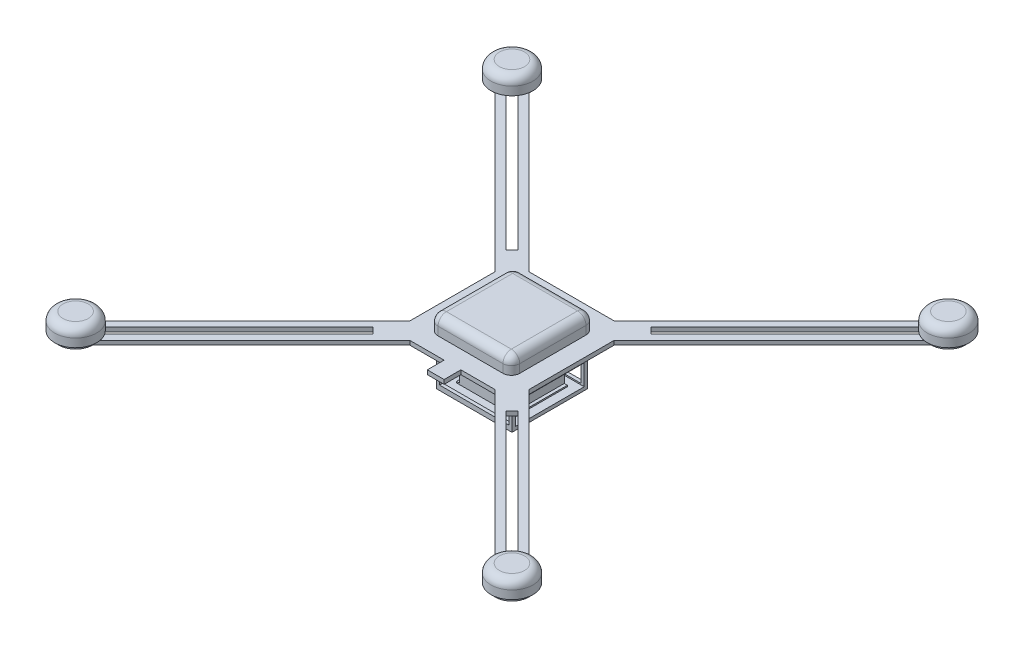
from build123d import *

# Parameters (mm, degrees)
EXTRUDE_1_DEPTH     = 5
SKETCH_2_W          = 90
SKETCH_2_H          = 90
EXTRUDE_2_DEPTH     = 25
SKETCH_3_W          = 82.667839838
SKETCH_3_H          = 15.058257345
CUT_EXTRUDE_1_DEPTH = 90
SKETCH_4_W          = 82.085695662
SKETCH_4_H          = 16.995101666
CUT_EXTRUDE_2_DEPTH = 90
SKETCH_5_W          = 97.364780094
SKETCH_5_H          = 98.94366842
EXTRUDE_3_DEPTH     = 20
FILLET_1_R          = 10
SKETCH_6_W          = 90
SKETCH_6_H          = 90
EXTRUDE_4_DEPTH     = 30
CUT_EXTRUDE_3_DEPTH = 90
SKETCH_8_W          = 62.667839838
SKETCH_8_H          = 13.124346315
CUT_EXTRUDE_4_DEPTH = 10
CUT_EXTRUDE_5_DEPTH = 90
SKETCH_10_W         = 62.085695662
SKETCH_10_H         = 21.626220655
CUT_EXTRUDE_6_DEPTH = 10
SKETCH_11_W         = 62.667839838
SKETCH_11_H         = 13.124346315
CUT_EXTRUDE_7_DEPTH = 10
SKETCH_12_W         = 62.085695662
SKETCH_12_H         = 21.626220655
CUT_EXTRUDE_8_DEPTH = 10
EXTRUDE_5_DEPTH     = 20
SKETCH_14_R         = 25
EXTRUDE_6_DEPTH     = 20
FILLET_2_R          = 10
SCALE_1_SCALE       = 0.5


with BuildPart() as part:
    # 草图1 → 凸台-拉伸1 (new body)
    with BuildSketch(Plane(origin=(0, 0, 0), x_dir=(1, 0, 0), z_dir=(0, 1, 0))):
        Polygon((0, 70.903454713), (0, 0), (70.90345471, 0), (70.90345471, 50.896669322), (70.90345471, 63.546624398), (70.90345471, 70.903454713), (63.546624395, 70.903454713), (50.896669319, 70.903454713), align=None)
        Polygon((72.962659229, 92.969444623), (50.896669319, 70.903454713), (63.546624395, 70.903454713), (79.287636767, 86.644467085), align=None)
        Polygon((70.90345471, 70.903454713), (70.90345471, 63.546624398), (86.644467082, 79.28763677), (79.287636767, 86.644467085), (63.546624395, 70.903454713), align=None)
        Polygon((70.90345471, 63.546624398), (70.90345471, 50.896669322), (92.96944462, 72.962659232), (86.644467082, 79.28763677), align=None)
        with BuildLine():
            ThreePointArc((242.661241038, 250.018071355), (240.67172678, 254.833829646), (239.993214606, 260))
            Line((239.993214606, 260), (72.962659229, 92.969444623))
            Line((72.962659229, 92.969444623), (79.287636767, 86.644467085))
            Line((79.287636767, 86.644467085), (242.661241038, 250.018071355))
        make_face()
        with BuildLine():
            Line((92.96944462, 72.962659232), (260, 239.993214612))
            ThreePointArc((260, 239.993214606), (254.833829644, 240.67172678), (250.018071352, 242.66124104))
            Line((250.018071352, 242.66124104), (86.644467082, 79.28763677))
            Line((86.644467082, 79.28763677), (92.96944462, 72.962659232))
        make_face()
        with BuildLine():
            Line((260, 252.643169688), (260, 239.993214612))
            ThreePointArc((260, 239.993214606), (274.146933622, 245.853066378), (280.006785394, 260))
            ThreePointArc((280.006785394, 260), (260, 280.006785394), (239.993214606, 260))
            Line((239.993214606, 260), (252.643169682, 260))
            Line((252.643169682, 260), (260, 260))
            Line((260, 260), (260, 252.643169688))
        make_face()
        with BuildLine():
            Line((252.643169682, 260), (239.993214606, 260))
            ThreePointArc((239.993214606, 260), (240.67172678, 254.833829646), (242.661241038, 250.018071355))
            Line((242.661241038, 250.018071355), (252.643169682, 260))
        make_face()
        with BuildLine():
            ThreePointArc((250.018071352, 242.66124104), (254.833829644, 240.67172678), (260, 239.993214606))
            Line((260, 239.993214612), (260, 252.643169688))
            Line((260, 252.643169688), (250.018071352, 242.66124104))
        make_face()
    extrude_1 = extrude(amount=EXTRUDE_1_DEPTH)

    # 镜向1: 凸台-拉伸1 across plane
    add(extrude_1.mirror(Plane(origin=(0, 5, 0), x_dir=(0, 0, 1), z_dir=(1, 0, 0))))

    # 镜向3: part across plane


with BuildPart() as part_1:
    add(part.part)
    add(part.part.mirror(Plane(origin=(0, 5, 0), x_dir=(1, 0, 0), z_dir=(0, 0, -1))))

    # 草图2 → 凸台-拉伸2 (add)
    with BuildSketch(Plane.XZ):
        Rectangle(SKETCH_2_W, SKETCH_2_H)
    extrude(amount=EXTRUDE_2_DEPTH)

    # 草图3 → 切除-拉伸1 (cut)
    with BuildSketch(Plane.XY.offset(45)):
        with Locations((0, -12.246888496)):
            Rectangle(SKETCH_3_W, SKETCH_3_H)
    extrude(amount=-CUT_EXTRUDE_1_DEPTH, mode=Mode.SUBTRACT)

    # 草图4 → 切除-拉伸2 (cut)
    with BuildSketch(Plane(origin=(45, 0, 0), x_dir=(0, 0, -1), z_dir=(1, 0, 0))):
        with Locations((0, -12.272398252)):
            Rectangle(SKETCH_4_W, SKETCH_4_H)
    extrude(amount=-CUT_EXTRUDE_2_DEPTH, mode=Mode.SUBTRACT)

    # 草图5 → 凸台-拉伸3 (add)
    with BuildSketch(Plane(origin=(0, 5, 0), x_dir=(1, 0, 0), z_dir=(0, 1, 0))):
        Rectangle(SKETCH_5_W, SKETCH_5_H)
    extrude(amount=EXTRUDE_3_DEPTH)

    # 圆角1
    fillet_1_edges = [part_1.edges().sort_by_distance(p)[0] for p in [
        (48.682390047, 15, 49.47183421),
        (48.682390047, 15, -49.47183421),
        (-48.682390047, 15, -49.47183421),
        (-48.682390047, 15, 49.47183421),
        (48.682390047, 25, 0),
        (0, 25, -49.47183421),
        (-48.682390047, 25, 0),
        (0, 25, 49.47183421),
    ]]
    fillet(fillet_1_edges, radius=FILLET_1_R)

    # 草图6 → 凸台-拉伸4 (add)
    with BuildSketch(Plane.XZ.offset(25)):
        Rectangle(SKETCH_6_W, SKETCH_6_H)
    extrude(amount=EXTRUDE_4_DEPTH)

    # 草图7 → 切除-拉伸3 (cut)
    with BuildSketch(Plane.XY.offset(45)):
        Polygon((-41.333919919, -25.414932676), (41.333919919, -25.414932676), (41.333919919, -49.347564191), (31.333919919, -49.347564191), (31.333919919, -36.223217876), (-31.333919919, -36.223217876), (-31.333919919, -49.347564191), (-41.333919919, -49.347564191), align=None)
    extrude(amount=-CUT_EXTRUDE_3_DEPTH, mode=Mode.SUBTRACT)

    # 草图8 → 切除-拉伸4 (cut)
    with BuildSketch(Plane.XY.offset(45)):
        with Locations((0, -42.785391034)):
            Rectangle(SKETCH_8_W, SKETCH_8_H)
    extrude(amount=-CUT_EXTRUDE_4_DEPTH, mode=Mode.SUBTRACT)

    # 草图9 → 切除-拉伸5 (cut)
    with BuildSketch(Plane(origin=(45, 0, 0), x_dir=(0, 0, -1), z_dir=(1, 0, 0))):
        Polygon((-41.042847831, -26.273596919), (-41.042847831, -50.943507888), (-31.042847831, -50.943507888), (-31.042847831, -29.317287233), (31.042847831, -29.317287233), (31.042847831, -50.943507888), (41.042847831, -50.943507888), (41.042847831, -26.273596919), align=None)
    extrude(amount=-CUT_EXTRUDE_5_DEPTH, mode=Mode.SUBTRACT)

    # 草图10 → 切除-拉伸6 (cut)
    with BuildSketch(Plane(origin=(45, 0, 0), x_dir=(0, 0, -1), z_dir=(1, 0, 0))):
        with Locations((0, -40.130397561)):
            Rectangle(SKETCH_10_W, SKETCH_10_H)
    extrude(amount=-CUT_EXTRUDE_6_DEPTH, mode=Mode.SUBTRACT)

    # 草图11 → 切除-拉伸7 (cut)
    with BuildSketch(Plane(origin=(0, 0, -45), x_dir=(-1, 0, 0), z_dir=(0, 0, -1))):
        with Locations((0, -42.785391034)):
            Rectangle(SKETCH_11_W, SKETCH_11_H)
    extrude(amount=-CUT_EXTRUDE_7_DEPTH, mode=Mode.SUBTRACT)

    # 草图12 → 切除-拉伸8 (cut)
    with BuildSketch(Plane.ZY.offset(45)):
        with Locations((0, -40.130397561)):
            Rectangle(SKETCH_12_W, SKETCH_12_H)
    extrude(amount=-CUT_EXTRUDE_8_DEPTH, mode=Mode.SUBTRACT)

    # 草图13 → 凸台-拉伸5 (add)
    with BuildSketch(Plane.XY.offset(70.903454713)):
        Polygon((0, 0), (-10, 0), (-10, 5), (10, 5), (10, 0), align=None)
    extrude(amount=EXTRUDE_5_DEPTH)

    # 草图14 → 凸台-拉伸6 (add)
    with BuildSketch(Plane(origin=(0, 5, 0), x_dir=(1, 0, 0), z_dir=(0, 1, 0))):
        with Locations(Location((-260, 260, 0), (0, 0, 349.463237906))):
            Circle(SKETCH_14_R)
        with Locations(Location((260, 260, 0), (0, 0, 190.536762094))):
            Circle(SKETCH_14_R)
        with Locations(Location((-260, -260, 0), (0, 0, 79.463237895))):
            Circle(SKETCH_14_R)
        with Locations(Location((260, -260, 0), (0, 0, 100.536762105))):
            Circle(SKETCH_14_R)
    extrude(amount=EXTRUDE_6_DEPTH)

    # 圆角2
    fillet_2_edges = [part_1.edges().sort_by_distance(p)[0] for p in [
        (-284.578444482, 25, -264.571659088),
        (284.578444482, 25, -264.571659088),
        (-264.571659093, 25, 284.578444482),
        (264.571659093, 25, 284.578444482),
    ]]
    fillet(fillet_2_edges, radius=FILLET_2_R)


with BuildPart() as part_2:
    # 缩放比例1: scaled about (0, -0.043580376, 0.226767714)
    add(part_1.part.scale(SCALE_1_SCALE).moved(Location((0, -0.021790188, 0.113383857))))


solid = part_2.part
